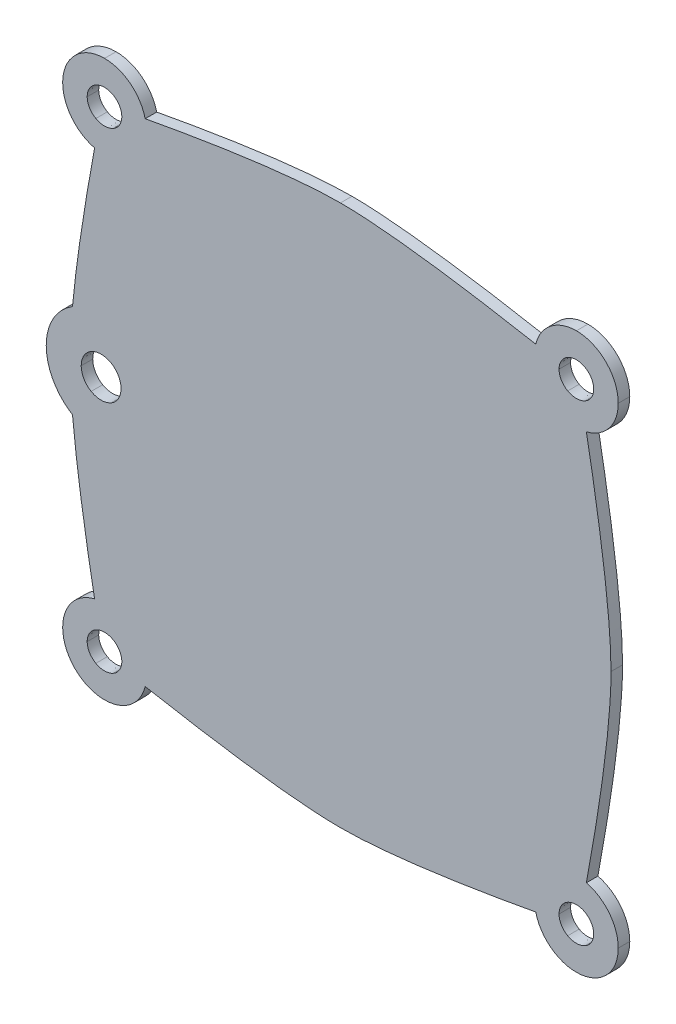
from build123d import *

# Parameters (mm, degrees)
BOSS_EXTRUDE1_DEPTH = 1.5875


with BuildPart() as part:
    # Model → Boss-Extrude1 (new body)
    with BuildSketch(Plane.XY):
        with BuildLine():
            add(Edge.make_bspline(
                [(89.679503, 301.313208), (86.494276, 301.313208), (83.911587, 298.730519), (83.911587, 295.545291)],
                knots=[0, 0, 0, 0, 1, 1, 1, 1], degree=3))
            add(Edge.make_bspline(
                [(83.911587, 295.545291), (83.911587, 292.829941), (85.785539, 290.557671), (88.31249, 289.944944)],
                knots=[0, 0, 0, 0, 1, 1, 1, 1], degree=3))
            add(Edge.make_bspline(
                [(88.31249, 289.944944), (87.310513, 284.565975), (85.908351, 276.388431), (85.260962, 269.483833)],
                knots=[0, 0, 0, 0, 1, 1, 1, 1], degree=3))
            add(Edge.make_bspline(
                [(85.260962, 269.483833), (83.093371, 268.154414), (81.64499, 265.765961), (81.64499, 263.036819)],
                knots=[0, 0, 0, 0, 1, 1, 1, 1], degree=3))
            add(Edge.make_bspline(
                [(81.64499, 263.036819), (81.64499, 260.307676), (83.093371, 257.910405), (85.260962, 256.580986)],
                knots=[0, 0, 0, 0, 1, 1, 1, 1], degree=3))
            add(Edge.make_bspline(
                [(85.260962, 256.580986), (85.906026, 249.677664), (87.302312, 241.509238), (88.30367, 236.128694)],
                knots=[0, 0, 0, 0, 1, 1, 1, 1], degree=3))
            add(Edge.make_bspline(
                [(88.30367, 236.128694), (85.780618, 235.513204), (83.911587, 233.240931), (83.911587, 230.528347)],
                knots=[0, 0, 0, 0, 1, 1, 1, 1], degree=3))
            add(Edge.make_bspline(
                [(83.911587, 230.528347), (83.911587, 227.343119), (86.494276, 224.76043), (89.679503, 224.76043)],
                knots=[0, 0, 0, 0, 1, 1, 1, 1], degree=3))
            add(Edge.make_bspline(
                [(89.679503, 224.76043), (92.392088, 224.76043), (94.664361, 226.629461), (95.279851, 229.152513)],
                knots=[0, 0, 0, 0, 1, 1, 1, 1], degree=3))
            add(Edge.make_bspline(
                [(95.279851, 229.152513), (102.491944, 227.810293), (114.729782, 225.757027), (122.187976, 225.757027)],
                knots=[0, 0, 0, 0, 1, 1, 1, 1], degree=3))
            add(Edge.make_bspline(
                [(122.187976, 225.757027), (129.646172, 225.757027), (141.884008, 227.810293), (149.096101, 229.152513)],
                knots=[0, 0, 0, 0, 1, 1, 1, 1], degree=3))
            add(Edge.make_bspline(
                [(149.096101, 229.152513), (149.711751, 226.629689), (151.984027, 224.76043), (154.696448, 224.76043)],
                knots=[0, 0, 0, 0, 1, 1, 1, 1], degree=3))
            add(Edge.make_bspline(
                [(154.696448, 224.76043), (157.881676, 224.76043), (160.464365, 227.343119), (160.464365, 230.528347)],
                knots=[0, 0, 0, 0, 1, 1, 1, 1], degree=3))
            add(Edge.make_bspline(
                [(160.464365, 230.528347), (160.464365, 233.238648), (158.592116, 235.510935), (156.072281, 236.128694)],
                knots=[0, 0, 0, 0, 1, 1, 1, 1], degree=3))
            add(Edge.make_bspline(
                [(156.072281, 236.128694), (157.414502, 243.340787), (159.467767, 255.578623), (159.467767, 263.036819)],
                knots=[0, 0, 0, 0, 1, 1, 1, 1], degree=3))
            add(Edge.make_bspline(
                [(159.467767, 263.036819), (159.467767, 270.495015), (157.414502, 282.732851), (156.072281, 289.944944)],
                knots=[0, 0, 0, 0, 1, 1, 1, 1], degree=3))
            add(Edge.make_bspline(
                [(156.072281, 289.944944), (158.591922, 290.562841), (160.464365, 292.835128), (160.464365, 295.545291)],
                knots=[0, 0, 0, 0, 1, 1, 1, 1], degree=3))
            add(Edge.make_bspline(
                [(160.464365, 295.545291), (160.464365, 298.730519), (157.881676, 301.313208), (154.696448, 301.313208)],
                knots=[0, 0, 0, 0, 1, 1, 1, 1], degree=3))
            add(Edge.make_bspline(
                [(154.696448, 301.313208), (151.986285, 301.313208), (149.713998, 299.440765), (149.096101, 296.921125)],
                knots=[0, 0, 0, 0, 1, 1, 1, 1], degree=3))
            add(Edge.make_bspline(
                [(149.096101, 296.921125), (141.884008, 298.263345), (129.646172, 300.316611), (122.187976, 300.316611)],
                knots=[0, 0, 0, 0, 1, 1, 1, 1], degree=3))
            add(Edge.make_bspline(
                [(122.187976, 300.316611), (114.728292, 300.316611), (102.490648, 298.255381), (95.279851, 296.912305)],
                knots=[0, 0, 0, 0, 1, 1, 1, 1], degree=3))
            add(Edge.make_bspline(
                [(95.279851, 296.912305), (94.665134, 299.436447), (92.392861, 301.313208), (89.679503, 301.313208)],
                knots=[0, 0, 0, 0, 1, 1, 1, 1], degree=3))
        make_face()
        with BuildLine():
            add(Edge.make_bspline(
                [(92.059468, 295.541961), (92.059468, 294.717126), (91.604739, 293.954948), (90.866572, 293.54253)],
                knots=[0, 0, 0, 0, 1, 1, 1, 1], degree=3))
            add(Edge.make_bspline(
                [(90.866572, 293.54253), (90.128406, 293.130113), (89.218948, 293.130113), (88.480782, 293.54253)],
                knots=[0, 0, 0, 0, 1, 1, 1, 1], degree=3))
            add(Edge.make_bspline(
                [(88.480782, 293.54253), (87.742615, 293.954948), (87.287886, 294.717126), (87.287886, 295.541961)],
                knots=[0, 0, 0, 0, 1, 1, 1, 1], degree=3))
            add(Edge.make_bspline(
                [(87.287886, 295.541961), (87.287886, 296.366796), (87.742615, 297.128975), (88.480782, 297.541392)],
                knots=[0, 0, 0, 0, 1, 1, 1, 1], degree=3))
            add(Edge.make_bspline(
                [(88.480782, 297.541392), (89.218948, 297.95381), (90.128406, 297.95381), (90.866572, 297.541392)],
                knots=[0, 0, 0, 0, 1, 1, 1, 1], degree=3))
            add(Edge.make_bspline(
                [(90.866572, 297.541392), (91.604739, 297.128975), (92.059468, 296.366796), (92.059468, 295.541961)],
                knots=[0, 0, 0, 0, 1, 1, 1, 1], degree=3))
        make_face(mode=Mode.SUBTRACT)
        with BuildLine():
            add(Edge.make_bspline(
                [(157.077982, 230.523445), (157.077982, 229.69861), (156.623252, 228.936431), (155.885086, 228.524014)],
                knots=[0, 0, 0, 0, 1, 1, 1, 1], degree=3))
            add(Edge.make_bspline(
                [(155.885086, 228.524014), (155.14692, 228.111596), (154.237461, 228.111596), (153.499295, 228.524014)],
                knots=[0, 0, 0, 0, 1, 1, 1, 1], degree=3))
            add(Edge.make_bspline(
                [(153.499295, 228.524014), (152.761129, 228.936431), (152.3064, 229.69861), (152.3064, 230.523445)],
                knots=[0, 0, 0, 0, 1, 1, 1, 1], degree=3))
            add(Edge.make_bspline(
                [(152.3064, 230.523445), (152.3064, 231.34828), (152.761129, 232.110458), (153.499295, 232.522876)],
                knots=[0, 0, 0, 0, 1, 1, 1, 1], degree=3))
            add(Edge.make_bspline(
                [(153.499295, 232.522876), (154.237461, 232.935293), (155.14692, 232.935293), (155.885086, 232.522876)],
                knots=[0, 0, 0, 0, 1, 1, 1, 1], degree=3))
            add(Edge.make_bspline(
                [(155.885086, 232.522876), (156.623252, 232.110458), (157.077982, 231.34828), (157.077982, 230.523445)],
                knots=[0, 0, 0, 0, 1, 1, 1, 1], degree=3))
        make_face(mode=Mode.SUBTRACT)
        with BuildLine():
            add(Edge.make_bspline(
                [(92.059468, 230.523445), (92.059468, 229.69861), (91.604739, 228.936431), (90.866572, 228.524014)],
                knots=[0, 0, 0, 0, 1, 1, 1, 1], degree=3))
            add(Edge.make_bspline(
                [(90.866572, 228.524014), (90.128406, 228.111596), (89.218948, 228.111596), (88.480782, 228.524014)],
                knots=[0, 0, 0, 0, 1, 1, 1, 1], degree=3))
            add(Edge.make_bspline(
                [(88.480782, 228.524014), (87.742615, 228.936431), (87.287886, 229.69861), (87.287886, 230.523445)],
                knots=[0, 0, 0, 0, 1, 1, 1, 1], degree=3))
            add(Edge.make_bspline(
                [(87.287886, 230.523445), (87.287886, 231.34828), (87.742615, 232.110458), (88.480782, 232.522876)],
                knots=[0, 0, 0, 0, 1, 1, 1, 1], degree=3))
            add(Edge.make_bspline(
                [(88.480782, 232.522876), (89.218948, 232.935293), (90.128406, 232.935293), (90.866572, 232.522876)],
                knots=[0, 0, 0, 0, 1, 1, 1, 1], degree=3))
            add(Edge.make_bspline(
                [(90.866572, 232.522876), (91.604739, 232.110458), (92.059468, 231.34828), (92.059468, 230.523445)],
                knots=[0, 0, 0, 0, 1, 1, 1, 1], degree=3))
        make_face(mode=Mode.SUBTRACT)
        with BuildLine():
            add(Edge.make_bspline(
                [(157.077982, 295.541958), (157.077982, 294.717124), (156.623252, 293.954945), (155.885086, 293.542527)],
                knots=[0, 0, 0, 0, 1, 1, 1, 1], degree=3))
            add(Edge.make_bspline(
                [(155.885086, 293.542527), (155.14692, 293.13011), (154.237461, 293.13011), (153.499295, 293.542527)],
                knots=[0, 0, 0, 0, 1, 1, 1, 1], degree=3))
            add(Edge.make_bspline(
                [(153.499295, 293.542527), (152.761129, 293.954945), (152.3064, 294.717124), (152.3064, 295.541958)],
                knots=[0, 0, 0, 0, 1, 1, 1, 1], degree=3))
            add(Edge.make_bspline(
                [(152.3064, 295.541958), (152.3064, 296.366793), (152.761129, 297.128972), (153.499295, 297.54139)],
                knots=[0, 0, 0, 0, 1, 1, 1, 1], degree=3))
            add(Edge.make_bspline(
                [(153.499295, 297.54139), (154.237461, 297.953807), (155.14692, 297.953807), (155.885086, 297.54139)],
                knots=[0, 0, 0, 0, 1, 1, 1, 1], degree=3))
            add(Edge.make_bspline(
                [(155.885086, 297.54139), (156.623252, 297.128972), (157.077982, 296.366793), (157.077982, 295.541958)],
                knots=[0, 0, 0, 0, 1, 1, 1, 1], degree=3))
        make_face(mode=Mode.SUBTRACT)
        with BuildLine():
            add(Edge.make_bspline(
                [(91.952335, 263.032707), (91.952995, 262.052038), (91.430193, 261.14558), (90.581018, 260.655055)],
                knots=[0, 0, 0, 0, 1, 1, 1, 1], degree=3))
            add(Edge.make_bspline(
                [(90.581018, 260.655055), (89.731844, 260.16453), (88.685427, 260.16453), (87.836253, 260.655055)],
                knots=[0, 0, 0, 0, 1, 1, 1, 1], degree=3))
            add(Edge.make_bspline(
                [(87.836253, 260.655055), (86.987078, 261.14558), (86.464276, 262.052038), (86.464936, 263.032707)],
                knots=[0, 0, 0, 0, 1, 1, 1, 1], degree=3))
            add(Edge.make_bspline(
                [(86.464936, 263.032707), (86.464276, 264.013376), (86.987078, 264.919834), (87.836253, 265.410359)],
                knots=[0, 0, 0, 0, 1, 1, 1, 1], degree=3))
            add(Edge.make_bspline(
                [(87.836253, 265.410359), (88.685427, 265.900884), (89.731844, 265.900884), (90.581018, 265.410359)],
                knots=[0, 0, 0, 0, 1, 1, 1, 1], degree=3))
            add(Edge.make_bspline(
                [(90.581018, 265.410359), (91.430193, 264.919834), (91.952995, 264.013376), (91.952335, 263.032707)],
                knots=[0, 0, 0, 0, 1, 1, 1, 1], degree=3))
        make_face(mode=Mode.SUBTRACT)
    extrude(amount=BOSS_EXTRUDE1_DEPTH)


solid = part.part
